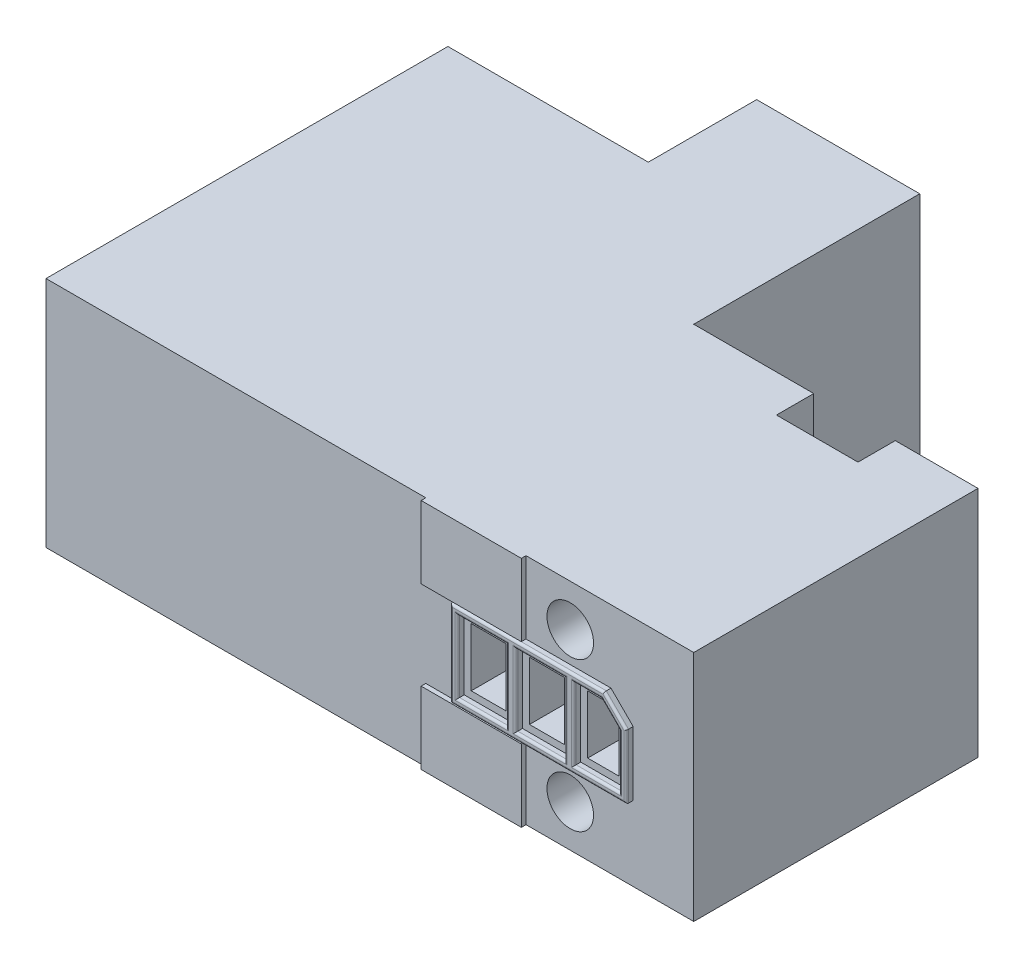
from build123d import *

# Parameters (mm, degrees)
BOSS_EXTRUDE1_DEPTH = 10
SKETCH2_W           = 1.5
SKETCH2_H           = 2.5
CUT_EXTRUDE1_DEPTH  = 17.9
SKETCH3_R           = 1
CUT_EXTRUDE2_DEPTH  = 37.775671306
CUT_EXTRUDE3_DEPTH  = 1.6
SKETCH5_W           = 2.1
SKETCH5_H           = 3.1
BOSS_EXTRUDE2_DEPTH = 0.3
FILLET1_R           = 0.1
SKETCH6_W           = 4.3
SKETCH6_H           = 3.1
BOSS_EXTRUDE3_DEPTH = 0.2


with BuildPart() as part:
    # Sketch1 → Boss-Extrude1 (new body)
    with BuildSketch(Plane(origin=(0, 0, 0), x_dir=(1, 0, 0), z_dir=(0, 1, 0))):
        Polygon((0, 0), (27.8, 0), (27.8, 12.2), (15.6, 12.2), (15.6, 21.9), (8.6, 21.9), (8.6, 17.25), (0, 17.25), align=None)
    extrude(amount=BOSS_EXTRUDE1_DEPTH)

    # Sketch2 → Cut-Extrude1 (cut)
    with BuildSketch(Plane.XY):
        with Locations((19, 5.05)):
            Rectangle(SKETCH2_W, SKETCH2_H)
        with Locations((21.5, 5.05)):
            Rectangle(SKETCH2_W, SKETCH2_H)
        Polygon((23.25, 6.3), (24, 6.3), (24.6, 5.7), (24.6, 3.8), (23.25, 3.8), align=None)
    extrude(amount=-CUT_EXTRUDE1_DEPTH, mode=Mode.SUBTRACT)

    # Sketch3 → Cut-Extrude2 (cut, through all)
    with BuildSketch(Plane.XY):
        with Locations((22.5, 8.2)):
            Circle(SKETCH3_R)
        with Locations((22.5, 1.8)):
            Circle(SKETCH3_R)
    extrude(amount=-CUT_EXTRUDE2_DEPTH, mode=Mode.SUBTRACT)

    # Sketch4 → Cut-Extrude3 (cut)
    with BuildSketch(Plane(origin=(0, 0, -12.2), x_dir=(-1, 0, 0), z_dir=(0, 0, -1))):
        with BuildLine():
            Line((-24.25, 8.2), (-24.25, 11.165081073))
            Line((-24.25, 11.165081073), (-20.75, 11.165081073))
            Line((-20.75, 11.165081073), (-20.75, 8.2))
            ThreePointArc((-20.75, 8.2), (-22.5, 6.45), (-24.25, 8.2))
        make_face()
        with BuildLine():
            Line((-20.75, -1.165081073), (-20.75, 1.8))
            ThreePointArc((-20.75, 1.8), (-22.5, 3.55), (-24.25, 1.8))
            Line((-24.25, 1.8), (-24.25, -1.165081073))
            Line((-24.25, -1.165081073), (-20.75, -1.165081073))
        make_face()
    extrude(amount=-CUT_EXTRUDE3_DEPTH, mode=Mode.SUBTRACT)

    # Sketch5 → Boss-Extrude2 (add)
    with BuildSketch(Plane.XY):
        Polygon((17.65, 6.9), (17.65, 3.2), (20.35, 3.2), (25.2, 3.2), (25.2, 5.948528137), (24.248528137, 6.9), align=None)
        with Locations((19, 5.05)):
            Rectangle(SKETCH5_W, SKETCH5_H, mode=Mode.SUBTRACT)
        with Locations((21.5, 5.05)):
            Rectangle(SKETCH5_W, SKETCH5_H, mode=Mode.SUBTRACT)
        Polygon((22.95, 6.6), (24.124264069, 6.6), (24.9, 5.824264069), (24.9, 3.5), (22.95, 3.5), align=None, mode=Mode.SUBTRACT)
    extrude(amount=BOSS_EXTRUDE2_DEPTH)

    # Fillet1
    fillet1_edges = [part.edges().sort_by_distance(p)[0] for p in [
        (20.949264069, 6.9, 0.3),
        (17.65, 5.05, 0.3),
        (21.425, 3.2, 0.3),
        (25.2, 4.574264069, 0.3),
        (24.724264069, 6.424264069, 0.3),
        (17.95, 5.05, 0.3),
        (19, 3.5, 0.3),
        (20.05, 5.05, 0.3),
        (19, 6.6, 0.3),
        (20.45, 5.05, 0.3),
        (21.5, 3.5, 0.3),
        (22.55, 5.05, 0.3),
        (21.5, 6.6, 0.3),
        (22.95, 5.05, 0.3),
        (23.925, 3.5, 0.3),
        (24.9, 4.662132034, 0.3),
        (24.512132034, 6.212132034, 0.3),
        (23.537132034, 6.6, 0.3),
    ]]
    fillet(fillet1_edges, radius=FILLET1_R)

    # Sketch6 → Boss-Extrude3 (add)
    with BuildSketch(Plane.XY):
        with Locations((18.45, 8.45)):
            Rectangle(SKETCH6_W, SKETCH6_H)
        with Locations((18.45, 1.55)):
            Rectangle(SKETCH6_W, SKETCH6_H)
    extrude(amount=BOSS_EXTRUDE3_DEPTH)


solid = part.part
